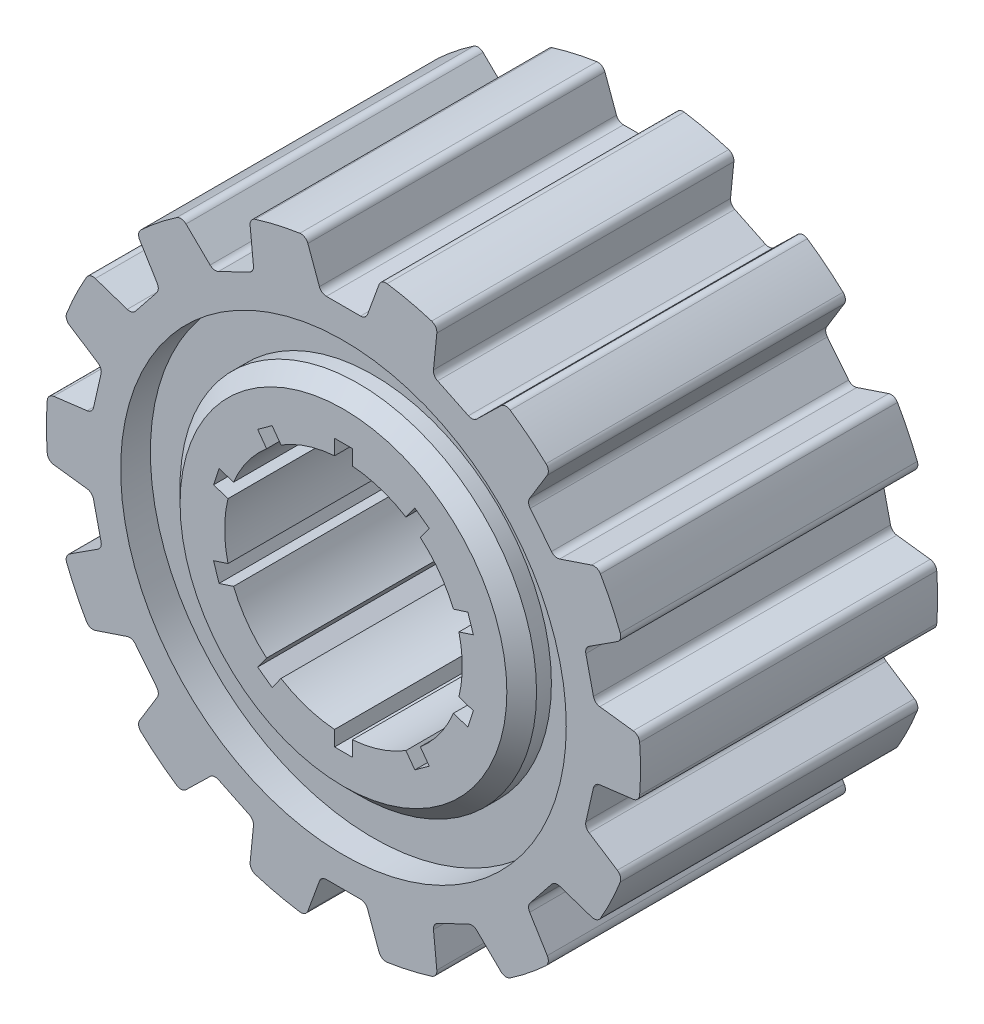
from build123d import *

# Parameters (mm, degrees)
SKETCH2_R           = 10
BOSS_EXTRUDE1_DEPTH = 5
CUT_EXTRUDE1_DEPTH  = 18.320508076
CIRPATTERN1_COUNT   = 14
SKETCH4_R           = 7.5
SKETCH4_R_2         = 6
CUT_EXTRUDE2_DEPTH  = 1
CHAMFER1_SIZE       = 0.5
CHAMFER2_SIZE       = 0.5
FILLET1_R           = 0.25


with BuildPart() as part:
    # Sketch2 → Boss-Extrude1 (new, symmetric)
    with BuildSketch(Plane.XY):
        Circle(SKETCH2_R)
        with BuildLine():
            Line((2.101814002, 3.403289277), (2.402328537, 3.81691205))
            Line((2.402328537, 3.81691205), (2.887738734, 3.464240899))
            Line((2.887738734, 3.464240899), (2.587224198, 3.050618126))
            ThreePointArc((2.587224198, 3.050618126), (3.236067977, 2.351141009), (3.700806493, 1.517903589))
            Line((3.700806493, 1.517903589), (4.187049225, 1.67589343))
            Line((4.187049225, 1.67589343), (4.372459422, 1.10525952))
            Line((4.372459422, 1.10525952), (3.886216689, 0.947269679))
            ThreePointArc((3.886216689, 0.947269679), (4, 0), (3.886216689, -0.947269679))
            Line((3.886216689, -0.947269679), (4.372459422, -1.10525952))
            Line((4.372459422, -1.10525952), (4.187049225, -1.67589343))
            Line((4.187049225, -1.67589343), (3.700806493, -1.517903589))
            ThreePointArc((3.700806493, -1.517903589), (3.236067977, -2.351141009), (2.587224198, -3.050618126))
            Line((2.587224198, -3.050618126), (2.887738734, -3.464240899))
            Line((2.887738734, -3.464240899), (2.402328537, -3.81691205))
            Line((2.402328537, -3.81691205), (2.101814002, -3.403289277))
            ThreePointArc((2.101814002, -3.403289277), (1.236067977, -3.804226065), (0.3, -3.988734135))
            Line((0.3, -3.988734135), (0.3, -4.5))
            Line((0.3, -4.5), (-0.3, -4.5))
            Line((-0.3, -4.5), (-0.3, -3.988734135))
            ThreePointArc((-0.3, -3.988734135), (-1.236067977, -3.804226065), (-2.101814002, -3.403289277))
            Line((-2.101814002, -3.403289277), (-2.402328537, -3.81691205))
            Line((-2.402328537, -3.81691205), (-2.887738734, -3.464240899))
            Line((-2.887738734, -3.464240899), (-2.587224198, -3.050618126))
            ThreePointArc((-2.587224198, -3.050618126), (-3.236067977, -2.351141009), (-3.700806493, -1.517903589))
            Line((-3.700806493, -1.517903589), (-4.187049225, -1.67589343))
            Line((-4.187049225, -1.67589343), (-4.372459422, -1.10525952))
            Line((-4.372459422, -1.10525952), (-3.886216689, -0.947269679))
            ThreePointArc((-3.886216689, -0.947269679), (-4, 0), (-3.886216689, 0.947269679))
            Line((-3.886216689, 0.947269679), (-4.372459422, 1.10525952))
            Line((-4.372459422, 1.10525952), (-4.187049225, 1.67589343))
            Line((-4.187049225, 1.67589343), (-3.700806493, 1.517903589))
            ThreePointArc((-3.700806493, 1.517903589), (-3.236067977, 2.351141009), (-2.587224198, 3.050618126))
            Line((-2.587224198, 3.050618126), (-2.887738734, 3.464240899))
            Line((-2.887738734, 3.464240899), (-2.402328537, 3.81691205))
            Line((-2.402328537, 3.81691205), (-2.101814002, 3.403289277))
            ThreePointArc((-2.101814002, 3.403289277), (-1.236067977, 3.804226065), (-0.3, 3.988734135))
            Line((-0.3, 3.988734135), (-0.3, 4.5))
            Line((-0.3, 4.5), (0.3, 4.5))
            Line((0.3, 4.5), (0.3, 3.988734135))
            ThreePointArc((0.3, 3.988734135), (1.236067977, 3.804226065), (2.101814002, 3.403289277))
        make_face(mode=Mode.SUBTRACT)
    extrude(amount=BOSS_EXTRUDE1_DEPTH, both=True)

    # Sketch3 → Cut-Extrude1 (cut, through all)
    with BuildSketch(Plane.XY.offset(5)):
        with BuildLine():
            Line((-0.75, 8.5), (0.75, 8.5))
            Line((0.75, 8.5), (1.266640021, 9.919456792))
            ThreePointArc((1.266640021, 9.919456792), (0, 10.615950068), (-1.266640021, 9.919456792))
            Line((-1.266640021, 9.919456792), (-0.75, 8.5))
        make_face()
    cut_extrude1 = extrude(amount=-CUT_EXTRUDE1_DEPTH, mode=Mode.SUBTRACT)

    # CirPattern1: Cut-Extrude1 ×14 about axis
    cirpattern1_axis = Axis((0, 0, 0), (0, 0, 1))
    for i in range(1, CIRPATTERN1_COUNT):
        add(cut_extrude1.rotate(cirpattern1_axis, i * 360 / CIRPATTERN1_COUNT), mode=Mode.SUBTRACT)

    # Sketch4 → Cut-Extrude2 (cut)
    with BuildSketch(Plane.XY.offset(5)):
        Circle(SKETCH4_R)
        Circle(SKETCH4_R_2, mode=Mode.SUBTRACT)
    cut_extrude2 = extrude(amount=-CUT_EXTRUDE2_DEPTH, mode=Mode.SUBTRACT)

    # Chamfer1
    chamfer1_edges = [part.edges().sort_by_distance(p)[0] for p in [
        (-6, 0, 5),
    ]]
    chamfer(chamfer1_edges, length=CHAMFER1_SIZE)

    # Mirror1: Cut-Extrude2 across plane
    add(cut_extrude2.mirror(Plane.XY), mode=Mode.SUBTRACT)

    # Chamfer2
    chamfer2_edges = [part.edges().sort_by_distance(p)[0] for p in [
        (-6, 0, -5),
    ]]
    chamfer(chamfer2_edges, length=CHAMFER2_SIZE)

    # Fillet1
    fillet1_edges = [part.edges().sort_by_distance(p)[0] for p in [
        (1.266640021, 9.919456792, 0),
        (0.75, 8.5, 0),
        (-0.75, 8.5, 0),
        (-1.266640021, 9.919456792, 0),
        (-6.965606473, 7.174979196, 0),
        (-6.17795025, 5.886036928, 0),
        (-7.113184952, 4.713289704, 0),
        (-8.545080745, 5.194381104, 0),
        (-9.38890138, 3.442169501, 0),
        (-8.119996553, 2.622623873, 0),
        (-8.453777954, 1.160232004, 0),
        (-9.952609221, 0.972404078, 0),
        (-9.952609221, -0.972404078, 0),
        (-8.453777954, -1.160232004, 0),
        (-8.119996553, -2.622623873, 0),
        (-9.38890138, -3.442169501, 0),
        (-8.545080745, -5.194381104, 0),
        (-7.113184952, -4.713289704, 0),
        (-6.17795025, -5.886036928, 0),
        (-6.965606473, -7.174979196, 0),
        (-5.445094229, -8.387547248, 0),
        (-4.363738433, -7.332822573, 0),
        (-3.012285132, -7.983648182, 0),
        (-3.162687777, -9.486696265, 0),
        (-1.266640021, -9.919456792, 0),
        (-0.75, -8.5, 0),
        (0.75, -8.5, 0),
        (1.266640021, -9.919456792, 0),
        (3.162687777, -9.486696265, 0),
        (3.012285132, -7.983648182, 0),
        (4.363738433, -7.332822573, 0),
        (5.445094229, -8.387547248, 0),
        (6.965606473, -7.174979196, 0),
        (6.17795025, -5.886036928, 0),
        (7.113184952, -4.713289704, 0),
        (8.545080745, -5.194381104, 0),
        (9.38890138, -3.442169501, 0),
        (8.119996553, -2.622623873, 0),
        (8.453777954, -1.160232004, 0),
        (9.952609221, -0.972404078, 0),
        (9.952609221, 0.972404078, 0),
        (8.453777954, 1.160232004, 0),
        (8.119996553, 2.622623873, 0),
        (9.38890138, 3.442169501, 0),
        (8.545080745, 5.194381104, 0),
        (7.113184952, 4.713289704, 0),
        (6.17795025, 5.886036928, 0),
        (6.965606473, 7.174979196, 0),
        (5.445094229, 8.387547248, 0),
        (4.363738433, 7.332822573, 0),
        (3.012285132, 7.983648182, 0),
        (3.162687777, 9.486696265, 0),
        (-3.162687777, 9.486696265, 0),
        (-3.012285132, 7.983648182, 0),
        (-4.363738433, 7.332822573, 0),
        (-5.445094229, 8.387547248, 0),
    ]]
    fillet(fillet1_edges, radius=FILLET1_R)


solid = part.part
